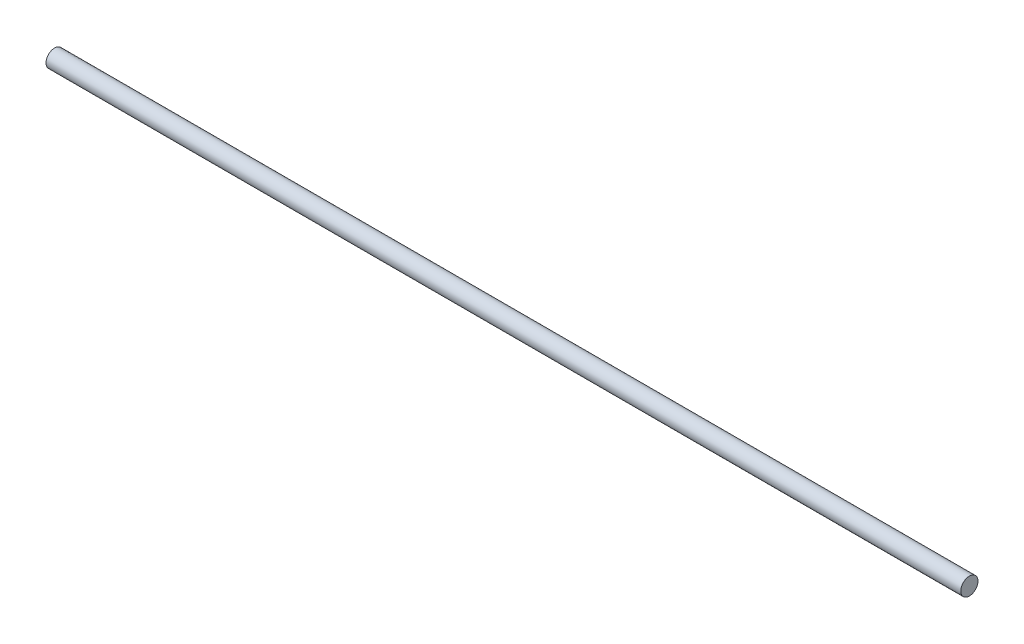
from build123d import *

# Parameters (mm, degrees)
SKETCH6_R           = 20
BOSS_EXTRUDE2_DEPTH = 2120


with BuildPart() as part:
    # Sketch6 → Boss-Extrude2 (new body)
    with BuildSketch(Plane(origin=(0, 0, 0), x_dir=(0, 0, -1), z_dir=(1, 0, 0))):
        Circle(SKETCH6_R)
    extrude(amount=BOSS_EXTRUDE2_DEPTH)


solid = part.part
